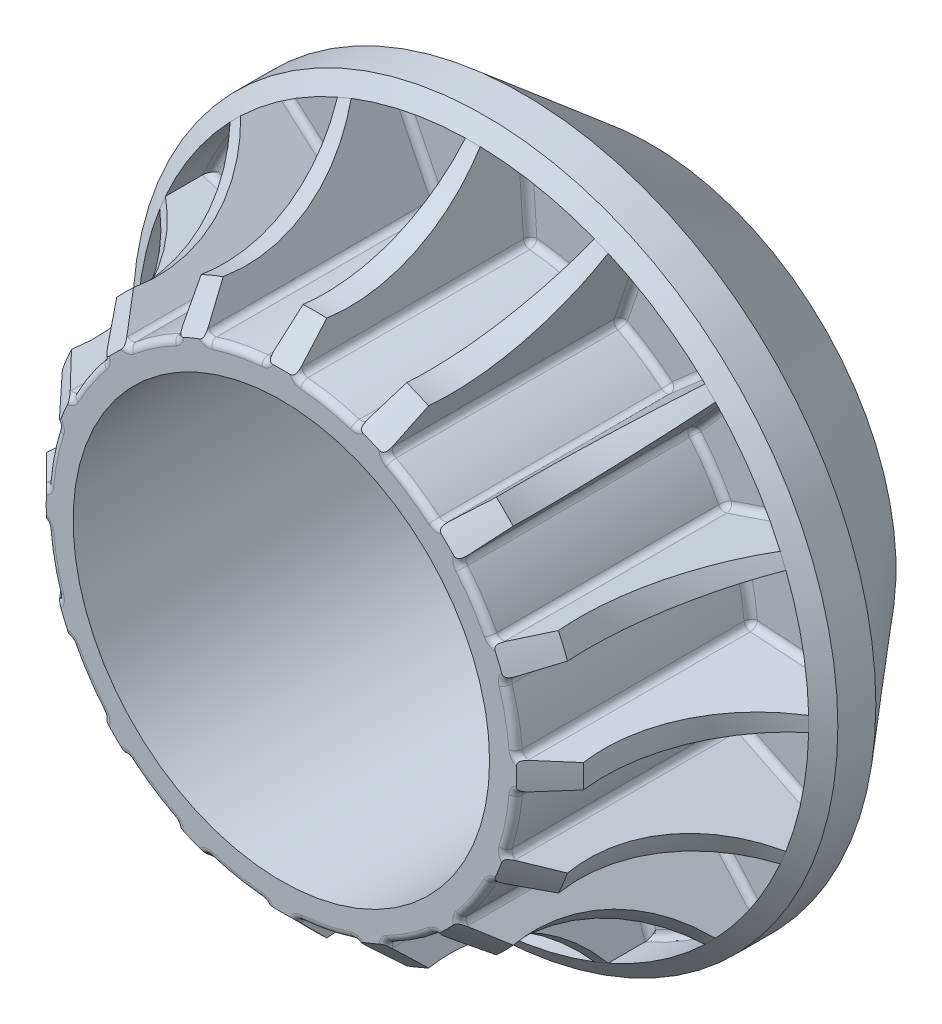
from build123d import *

# Parameters (mm, degrees)
SKETCH1_R           = 35
SKETCH1_R_2         = 31
BOSS_EXTRUDE1_DEPTH = 55
BOSS_EXTRUDE2_REACH = 94.399
CIRPATTERN1_COUNT   = 16
FILLET1_R           = 1


with BuildPart() as part:
    # Sketch1 → Boss-Extrude1 (new body)
    with BuildSketch(Plane.XY):
        Circle(SKETCH1_R)
        Circle(SKETCH1_R_2, mode=Mode.SUBTRACT)
    extrude(amount=-BOSS_EXTRUDE1_DEPTH)

    # Sketch2 → Revolve1 (revolve)
    with BuildSketch(Plane(origin=(0, 0, 0), x_dir=(0, 0, -1), z_dir=(1, 0, 0)), mode=Mode.PRIVATE) as revolve1_sk:
        Polygon((55, 35), (35, 35), (35, 50), (28.5, 50), (28.5, 52.5), (36, 52.5), (55, 36.5), align=None)
    revolve(revolve1_sk.sketch.rotate(Axis((0, 0, -55), (0, 0, 1)), 90), axis=Axis((0, 0, -55), (0, 0, 1)))

    # Boss-Extrude2: up to this face of the body (flat: up to its plane)
    boss_extrude2_end = Plane(part.part.faces().sort_by_distance((-36.414213562, 0, -35))[0])
    # Sketch3 → Boss-Extrude2 (add, up to the picked face)
    with BuildSketch(Plane.XY, mode=Mode.PRIVATE) as boss_extrude2_sk1:
        with BuildLine():
            Line((-1.1, 49.987898536), (-2.1, 34.936943198))
            ThreePointArc((-2.1, 34.936943198), (0, 35), (2.1, 34.936943198))
            Line((2.1, 34.936943198), (1.1, 49.987898536))
            ThreePointArc((1.1, 49.987898536), (0, 50), (-1.1, 49.987898536))
        make_face()
    boss_extrude2_tool1 = split(extrude(boss_extrude2_sk1.sketch, amount=-BOSS_EXTRUDE2_REACH, mode=Mode.PRIVATE), bisect_by=boss_extrude2_end, keep=Keep.BOTH, mode=Mode.PRIVATE)
    boss_extrude2 = boss_extrude2_tool1.solids().sort_by(Axis((0, 41.706298, 0), (0, 0, -1)))[0]
    add(boss_extrude2)

    # CirPattern1: Boss-Extrude2 ×16 about axis
    cirpattern1_axis = Axis((0, 0, 0), (0, 0, 1))
    for i in range(1, CIRPATTERN1_COUNT):
        add(boss_extrude2.rotate(cirpattern1_axis, i * 360 / CIRPATTERN1_COUNT))

    # Fillet1
    fillet1_edges = [part.edges().sort_by_distance(p)[0] for p in [
        (-38.617868048, -17.727872216, -35),
        (-39.842455031, -14.771457712, -35),
        (-19.444958156, -29.101436431, 0),
        (-41.573480615, -27.778511651, -35),
        (-29.101436431, -19.444958156, -35),
        (-26.18907369, -23.219225209, -17.5),
        (-23.219225209, -26.18907369, -17.5),
        (-31.15683659, -28.89409489, 0),
        (-28.89409489, -31.15683659, 0),
        (-28.89409489, -31.15683659, -35),
        (-31.15683659, -28.89409489, -35),
        (-6.828161271, -34.327484814, 0),
        (-27.778511651, -41.573480615, -35),
        (-19.444958156, -29.101436431, -35),
        (-15.309936358, -31.473891541, -17.5),
        (-11.429642321, -33.081161957, -17.5),
        (-17.727872216, -38.617868048, 0),
        (-14.771457712, -39.842455031, 0),
        (-14.771457712, -39.842455031, -35),
        (-17.727872216, -38.617868048, -35),
        (6.828161271, -34.327484814, 0),
        (-9.754516101, -49.03926402, -35),
        (-6.828161271, -34.327484814, -35),
        (-2.1, -34.936943198, -17.5),
        (2.1, -34.936943198, -17.5),
        (-1.6, -42.462420867, 0),
        (1.6, -42.462420867, 0),
        (1.6, -42.462420867, -35),
        (-1.6, -42.462420867, -35),
        (19.444958156, -29.101436431, 0),
        (9.754516101, -49.03926402, -35),
        (6.828161271, -34.327484814, -35),
        (11.429642321, -33.081161957, -17.5),
        (15.309936358, -31.473891541, -17.5),
        (14.771457712, -39.842455031, 0),
        (17.727872216, -38.617868048, 0),
        (17.727872216, -38.617868048, -35),
        (14.771457712, -39.842455031, -35),
        (29.101436431, -19.444958156, 0),
        (27.778511651, -41.573480615, -35),
        (19.444958156, -29.101436431, -35),
        (23.219225209, -26.18907369, -17.5),
        (26.18907369, -23.219225209, -17.5),
        (28.89409489, -31.15683659, 0),
        (31.15683659, -28.89409489, 0),
        (31.15683659, -28.89409489, -35),
        (28.89409489, -31.15683659, -35),
        (34.327484814, -6.828161271, 0),
        (41.573480615, -27.778511651, -35),
        (9.754516101, 49.03926402, -35),
        (29.101436431, -19.444958156, -35),
        (31.473891541, -15.309936358, -17.5),
        (33.081161957, -11.429642321, -17.5),
        (38.617868048, -17.727872216, 0),
        (39.842455031, -14.771457712, 0),
        (39.842455031, -14.771457712, -35),
        (38.617868048, -17.727872216, -35),
        (6.828161271, 34.327484814, -35),
        (34.327484814, 6.828161271, 0),
        (49.03926402, -9.754516101, -35),
        (34.327484814, -6.828161271, -35),
        (34.936943198, -2.1, -17.5),
        (34.936943198, 2.1, -17.5),
        (42.462420867, -1.6, 0),
        (42.462420867, 1.6, 0),
        (42.462420867, 1.6, -35),
        (42.462420867, -1.6, -35),
        (-6.828161271, 34.327484814, 0),
        (29.101436431, 19.444958156, 0),
        (49.03926402, 9.754516101, -35),
        (34.327484814, 6.828161271, -35),
        (33.081161957, 11.429642321, -17.5),
        (31.473891541, 15.309936358, -17.5),
        (39.842455031, 14.771457712, 0),
        (2.1, 34.936943198, -17.5),
        (38.617868048, 17.727872216, 0),
        (38.617868048, 17.727872216, -35),
        (39.842455031, 14.771457712, -35),
        (-2.1, 34.936943198, -17.5),
        (19.444958156, 29.101436431, 0),
        (1.6, 42.462420867, 0),
        (41.573480615, 27.778511651, -35),
        (29.101436431, 19.444958156, -35),
        (26.18907369, 23.219225209, -17.5),
        (23.219225209, 26.18907369, -17.5),
        (31.15683659, 28.89409489, 0),
        (28.89409489, 31.15683659, 0),
        (-1.6, 42.462420867, 0),
        (28.89409489, 31.15683659, -35),
        (31.15683659, 28.89409489, -35),
        (-1.6, 42.462420867, -35),
        (1.6, 42.462420867, -35),
        (6.828161271, 34.327484814, 0),
        (27.778511651, 41.573480615, -35),
        (19.444958156, 29.101436431, -35),
        (15.309936358, 31.473891541, -17.5),
        (11.429642321, 33.081161957, -17.5),
        (17.727872216, 38.617868048, 0),
        (14.771457712, 39.842455031, 0),
        (14.771457712, 39.842455031, -35),
        (17.727872216, 38.617868048, -35),
        (-9.754516101, 49.03926402, -35),
        (-6.828161271, 34.327484814, -35),
        (-19.444958156, 29.101436431, 0),
        (-11.429642321, 33.081161957, -17.5),
        (-15.309936358, 31.473891541, -17.5),
        (-14.771457712, 39.842455031, 0),
        (-17.727872216, 38.617868048, 0),
        (-17.727872216, 38.617868048, -35),
        (-14.771457712, 39.842455031, -35),
        (-29.101436431, 19.444958156, 0),
        (-27.778511651, 41.573480615, -35),
        (-19.444958156, 29.101436431, -35),
        (-23.219225209, 26.18907369, -17.5),
        (-26.18907369, 23.219225209, -17.5),
        (-28.89409489, 31.15683659, 0),
        (-31.15683659, 28.89409489, 0),
        (-31.15683659, 28.89409489, -35),
        (-28.89409489, 31.15683659, -35),
        (-34.327484814, 6.828161271, 0),
        (-41.573480615, 27.778511651, -35),
        (-29.101436431, 19.444958156, -35),
        (-31.473891541, 15.309936358, -17.5),
        (-33.081161957, 11.429642321, -17.5),
        (-38.617868048, 17.727872216, 0),
        (-39.842455031, 14.771457712, 0),
        (-39.842455031, 14.771457712, -35),
        (-38.617868048, 17.727872216, -35),
        (-34.327484814, -6.828161271, 0),
        (-49.03926402, 9.754516101, -35),
        (-34.327484814, 6.828161271, -35),
        (-34.936943198, 2.1, -17.5),
        (-34.936943198, -2.1, -17.5),
        (-42.462420867, 1.6, 0),
        (-42.462420867, -1.6, 0),
        (-42.462420867, -1.6, -35),
        (-42.462420867, 1.6, -35),
        (-29.101436431, -19.444958156, 0),
        (-49.03926402, -9.754516101, -35),
        (-34.327484814, -6.828161271, -35),
        (-33.081161957, -11.429642321, -17.5),
        (-31.473891541, -15.309936358, -17.5),
        (-39.842455031, -14.771457712, 0),
        (-38.617868048, -17.727872216, 0),
    ]]
    fillet(fillet1_edges, radius=FILLET1_R)

    # Sketch4 → Cut-Revolve1 (revolve, cut)
    with BuildSketch(Plane(origin=(0, 0, 0), x_dir=(0, 0, -1), z_dir=(1, 0, 0)), mode=Mode.PRIVATE) as cut_revolve1_sk:
        with BuildLine():
            Line((0, 35), (5, 40))
            ThreePointArc((5, 40), (18.121331433, 41.767415821), (28.5, 49.987898536))
            Line((28.5, 49.987898536), (32.507055564, 55.450043239))
            Line((32.507055564, 55.450043239), (0, 55.450043239))
            Line((0, 55.450043239), (0, 35))
        make_face()
    revolve(cut_revolve1_sk.sketch.rotate(Axis((0, 0, -55), (0, 0, 1)), 90), axis=Axis((0, 0, -55), (0, 0, 1)), mode=Mode.SUBTRACT)


solid = part.part
